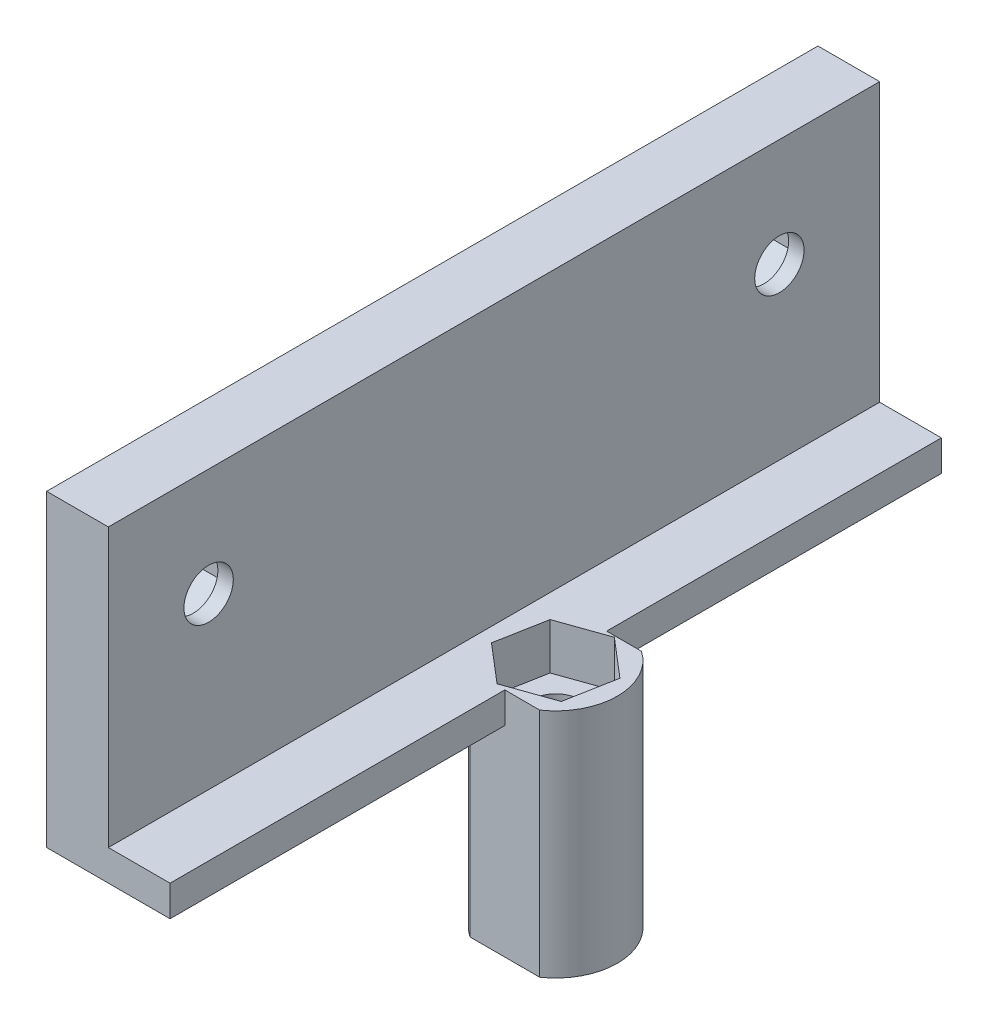
from build123d import *

# Parameters (mm, degrees)
CROQUIS5_R              = 1.6
SALIENTE_EXTRUIR3_DEPTH = 15
SALIENTE_EXTRUIR5_DEPTH = 2
CORTAR_EXTRUIR3_DEPTH   = 3
CROQUIS10_W             = 4
CROQUIS10_H             = 50
SALIENTE_EXTRUIR6_DEPTH = 18
CROQUIS17_R             = 1.6
CORTAR_EXTRUIR4_DEPTH   = 4
CORTAR_EXTRUIR6_DEPTH   = 3


with BuildPart() as part:
    # Croquis5 → Saliente-Extruir3 (new body)
    with BuildSketch(Plane(origin=(0, 0, 0), x_dir=(1, 0, 0), z_dir=(0, 1, 0))):
        with BuildLine():
            Line((-65.609813571, 16.762782914), (-61.088751749, 16.762782914))
            ThreePointArc((-61.088751749, 16.762782914), (-59.34928266, 13.462782914), (-61.088751749, 10.162782914))
            Line((-61.088751749, 10.162782914), (-65.609813571, 10.162782914))
            ThreePointArc((-65.609813571, 10.162782914), (-67.34928266, 13.462782914), (-65.609813571, 16.762782914))
        make_face()
        with Locations(Location((-63.34928266, 13.462782914, 0), (0, 0, 270))):
            Circle(CROQUIS5_R, mode=Mode.SUBTRACT)
    extrude(amount=SALIENTE_EXTRUIR3_DEPTH)

    # Croquis7 → Saliente-Extruir5 (add)
    with BuildSketch(Plane(origin=(0, 15, 0), x_dir=(1, 0, 0), z_dir=(0, 1, 0))):
        Polygon((-63.34928266, 13.462782914), (-63.34928266, -11.537217086), (-71.34928266, -11.537217086), (-71.34928266, 38.462782914), (-63.34928266, 38.462782914), align=None)
    extrude(amount=-SALIENTE_EXTRUIR5_DEPTH)

    # Croquis9 → Cortar-Extruir3 (cut)
    with BuildSketch(Plane(origin=(0, 15, 0), x_dir=(1, 0, 0), z_dir=(0, 1, 0))):
        Polygon((-60.274222832, 14.551286652), (-62.754424635, 16.670114712), (-65.829484463, 15.581610975), (-66.424342488, 12.374279177), (-63.944140685, 10.255451116), (-60.869080857, 11.343954853), align=None)
    extrude(amount=-CORTAR_EXTRUIR3_DEPTH, mode=Mode.SUBTRACT)

    # Croquis10 → Saliente-Extruir6 (add)
    with BuildSketch(Plane(origin=(0, 15, 0), x_dir=(1, 0, 0), z_dir=(0, 1, 0))):
        with Locations((-69.34928266, 13.462782914)):
            Rectangle(CROQUIS10_W, CROQUIS10_H)
    extrude(amount=SALIENTE_EXTRUIR6_DEPTH)

    # Croquis17 → Cortar-Extruir4 (cut)
    with BuildSketch(Plane(origin=(-67.34928266, 0, 0), x_dir=(0, 0, -1), z_dir=(1, 0, 0))):
        with Locations((-5.037217086, 26)):
            Circle(CROQUIS17_R)
        with Locations(Location((31.962782914, 26, 0), (0, 0, 180))):
            Circle(CROQUIS17_R)
    extrude(amount=-CORTAR_EXTRUIR4_DEPTH, mode=Mode.SUBTRACT)

    # Croquis19 → Cortar-Extruir6 (cut)
    with BuildSketch(Plane.ZY.offset(71.34928266)):
        Polygon((-31.962782914, 29.233161507), (-34.762782914, 27.616580754), (-34.762782914, 24.383419246), (-31.962782914, 22.766838493), (-29.162782914, 24.383419246), (-29.162782914, 27.616580754), align=None)
        Polygon((2.237217086, 27.616580754), (5.037217086, 29.233161507), (7.837217086, 27.616580754), (7.837217086, 24.383419246), (5.037217086, 22.766838493), (2.237217086, 24.383419246), align=None)
    extrude(amount=-CORTAR_EXTRUIR6_DEPTH, mode=Mode.SUBTRACT)


solid = part.part
